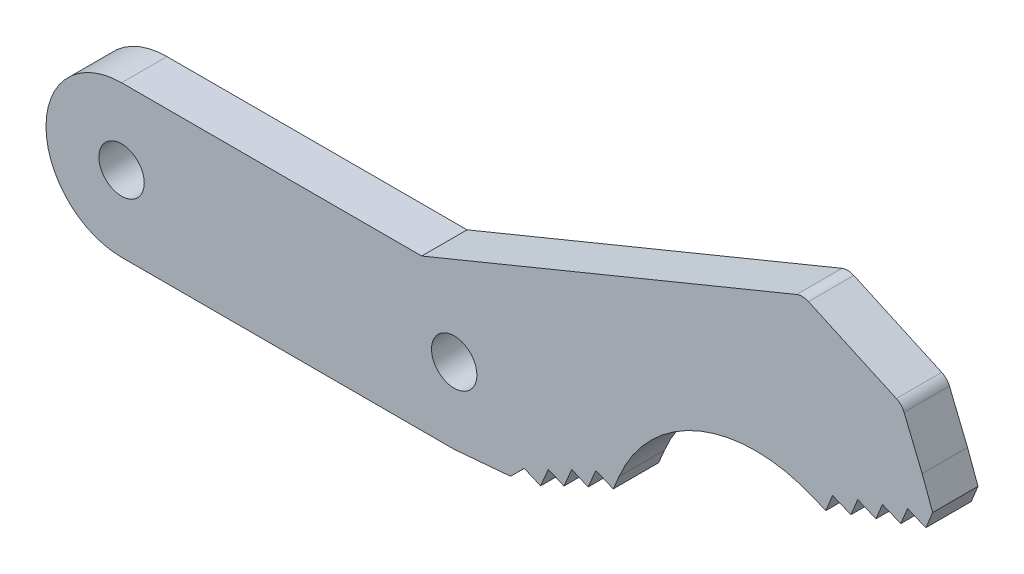
from build123d import *

# Parameters (mm, degrees)
SKETCH1_R           = 1.5
BOSS_EXTRUDE1_DEPTH = 3


with BuildPart() as part:
    # Sketch1 → Boss-Extrude1 (new body)
    with BuildSketch(Plane.XY):
        with BuildLine():
            Line((0, 5), (19.85, 5))
            Line((19.85, 5), (44.643069029, 15.193663072))
            ThreePointArc((44.643069029, 15.193663072), (45.042006379, 15.268610471), (45.43786686, 15.178818479))
            Line((45.43786686, 15.178818479), (51.245085043, 12.533540635))
            ThreePointArc((51.245085043, 12.533540635), (51.550738574, 12.317286013), (51.755428853, 12.003770413))
            Line((51.755428853, 12.003770413), (52.954960556, 9.086264498))
            Line((52.954960556, 9.086264498), (53.647413738, 7.201821951))
            Line((53.647413738, 7.201821951), (53.200417763, 6.109762155))
            Line((53.200417763, 6.109762155), (51.987413738, 6.606262365))
            Line((51.987413738, 6.606262365), (51.540417763, 5.514202569))
            Line((51.540417763, 5.514202569), (50.327413738, 6.010702778))
            Line((50.327413738, 6.010702778), (49.901790908, 4.970859901))
            Line((49.901790908, 4.970859901), (48.688786884, 5.467360111))
            Line((48.688786884, 5.467360111), (48.241790908, 4.375300315))
            Line((48.241790908, 4.375300315), (47.028786884, 4.871800524))
            Line((47.028786884, 4.871800524), (46.581790908, 3.779740729))
            Line((46.581790908, 3.779740729), (45.736822648, 4.125598541))
            ThreePointArc((45.736822648, 4.125598541), (38.240209852, 4.168619257), (32.907533275, -1.100499713))
            Line((32.907533275, -1.100499713), (32.521118505, -2.009071771))
            Line((32.521118505, -2.009071771), (31.373673566, -1.521064608))
            Line((31.373673566, -1.521064608), (30.860706561, -2.727197301))
            Line((30.860706561, -2.727197301), (29.774832981, -2.265376374))
            Line((29.774832981, -2.265376374), (29.261865976, -3.471509067))
            Line((29.261865976, -3.471509067), (28.227913521, -3.031770141))
            Line((28.227913521, -3.031770141), (27.714946516, -4.237902834))
            Line((27.714946516, -4.237902834), (26.629072936, -3.776081907))
            Line((26.629072936, -3.776081907), (25.729131342, -4.679393535))
            Line((25.729131342, -4.679393535), (22, -5))
            Line((22, -5), (0, -5))
            ThreePointArc((0, -5), (-5, 0), (0, 5))
        make_face()
        Circle(SKETCH1_R, mode=Mode.SUBTRACT)
        with Locations((22, 0)):
            Circle(SKETCH1_R, mode=Mode.SUBTRACT)
    extrude(amount=BOSS_EXTRUDE1_DEPTH)


solid = part.part
